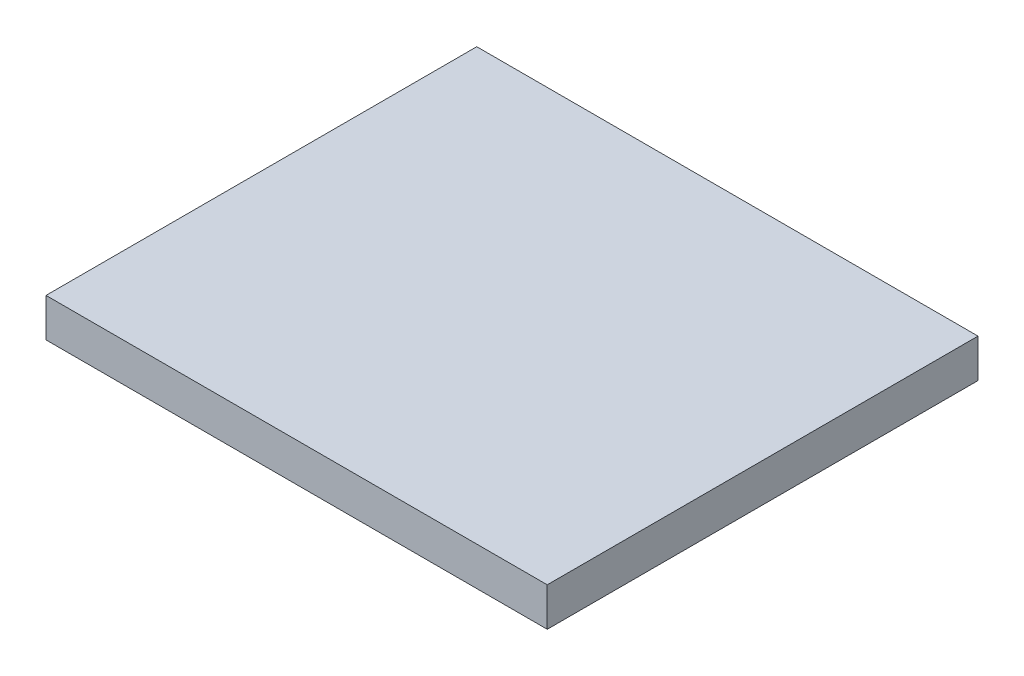
from build123d import *

# Parameters (mm, degrees)
SKETCH1_W           = 65.024
SKETCH1_H           = 55.88
BOSS_EXTRUDE1_DEPTH = 5


with BuildPart() as part:
    # Sketch1 → Boss-Extrude1 (new body)
    with BuildSketch(Plane(origin=(0, 0, 0), x_dir=(1, 0, 0), z_dir=(0, 1, 0))):
        with Locations((32.512, 27.94)):
            Rectangle(SKETCH1_W, SKETCH1_H)
    extrude(amount=BOSS_EXTRUDE1_DEPTH)


solid = part.part
